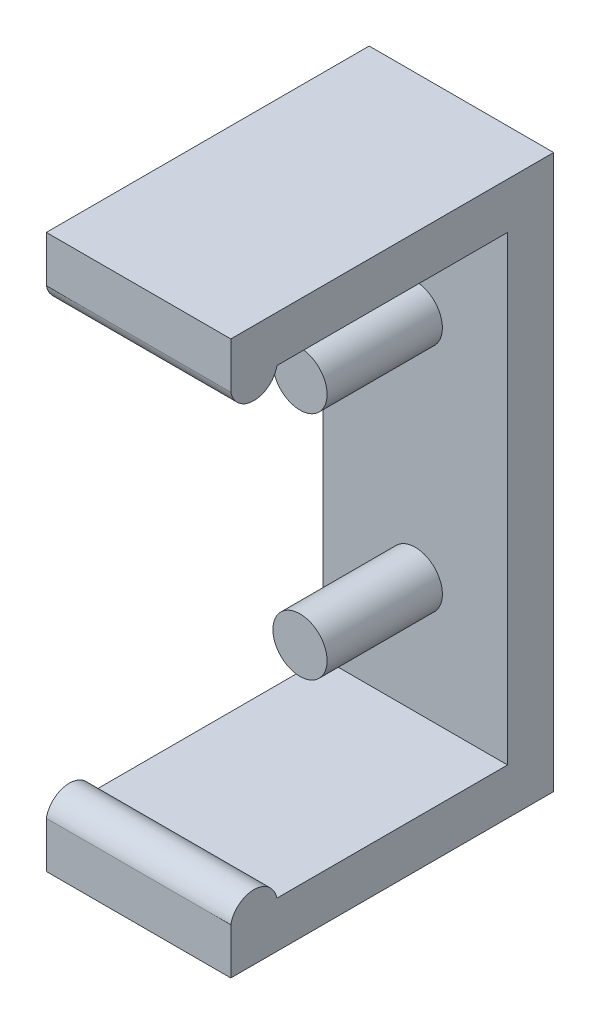
from build123d import *

# Parameters (mm, degrees)
SKETCH1_W           = 8
SKETCH1_H           = 24
BOSS_EXTRUDE1_DEPTH = 2
SKETCH2_W           = 8
SKETCH2_H           = 2
BOSS_EXTRUDE2_DEPTH = 12
BOSS_EXTRUDE4_DEPTH = 8
SKETCH4_R           = 1.175
BOSS_EXTRUDE5_DEPTH = 5


with BuildPart() as part:
    # Sketch1 → Boss-Extrude1 (new body)
    with BuildSketch(Plane.XY):
        Rectangle(SKETCH1_W, SKETCH1_H)
    extrude(amount=BOSS_EXTRUDE1_DEPTH)

    # Sketch2 → Boss-Extrude2 (add)
    with BuildSketch(Plane.XY.offset(2)):
        with Locations((0, 11)):
            Rectangle(SKETCH2_W, SKETCH2_H)
        with Locations((0, -11)):
            Rectangle(SKETCH2_W, SKETCH2_H)
    extrude(amount=BOSS_EXTRUDE2_DEPTH)

    # Sketch3 → Boss-Extrude4 (add)
    with BuildSketch(Plane(origin=(4, 0, 0), x_dir=(0, 0, -1), z_dir=(1, 0, 0))):
        with BuildLine():
            ThreePointArc((-12, -10), (-13, -9.180997512), (-14, -10))
            Line((-14, -10), (-12, -10))
        make_face()
        with BuildLine():
            ThreePointArc((-12, 10), (-13, 9.180997512), (-14, 10))
            Line((-14, 10), (-12, 10))
        make_face()
    extrude(amount=-BOSS_EXTRUDE4_DEPTH)

    # Sketch4 → Boss-Extrude5 (add)
    with BuildSketch(Plane.XY.offset(2)):
        with Locations((0, -5)):
            Circle(SKETCH4_R)
        with Locations((0, 5)):
            Circle(SKETCH4_R)
    extrude(amount=BOSS_EXTRUDE5_DEPTH)


solid = part.part
